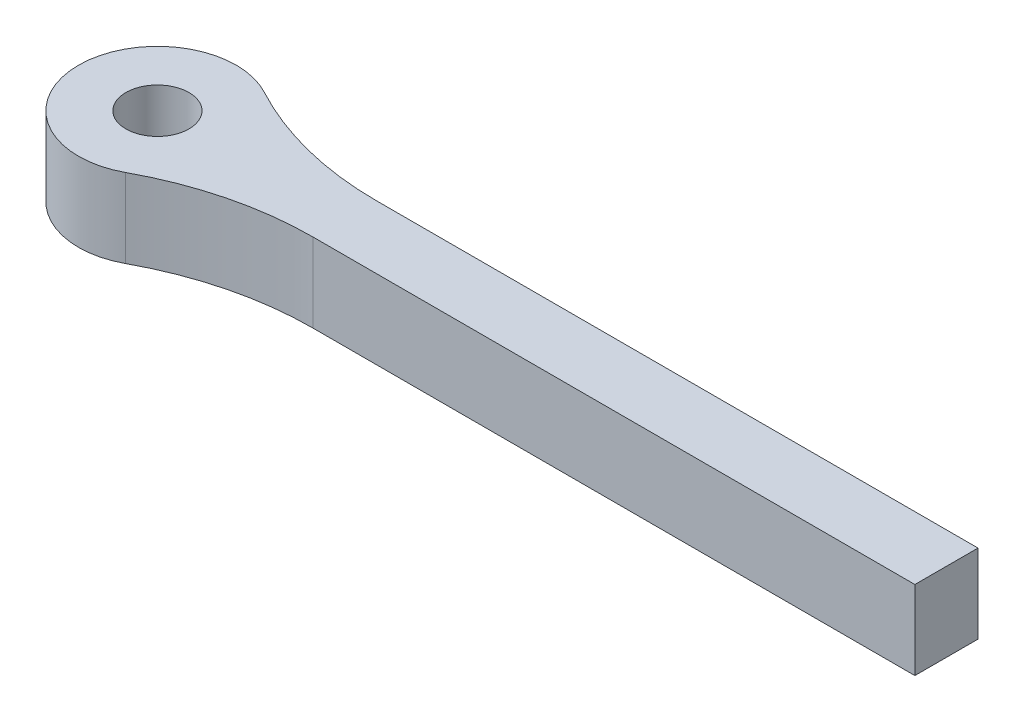
from build123d import *

# Parameters (mm, degrees)
BOSS_EXTRUDE1_DEPTH = 7.5
FILLET1_R           = 30
FILLET2_R           = 30


with BuildPart() as part:
    # Sketch1 → Boss-Extrude1 (new body)
    with BuildSketch(Plane(origin=(0, 0, 0), x_dir=(1, 0, 0), z_dir=(0, 1, 0))):
        with BuildLine():
            ThreePointArc((-58.191489362, -2.446808511), (-61.191489362, 0.553191489), (-58.191489362, 3.553191489))
            Line((-58.191489362, 3.553191489), (-51.317625819, 3.553191489))
            ThreePointArc((-51.317625819, 3.553191489), (-65.691489362, 0.553191489), (-51.317625819, -2.446808511))
            Line((-51.317625819, -2.446808511), (-58.191489362, -2.446808511))
        make_face()
        with BuildLine():
            Line((-51.317625819, 3.553191489), (-58.191489362, 3.553191489))
            ThreePointArc((-58.191489362, 3.553191489), (-56.070169018, 2.674511833), (-55.191489362, 0.553191489))
            ThreePointArc((-55.191489362, 0.553191489), (-56.070169018, -1.568128854), (-58.191489362, -2.446808511))
            Line((-58.191489362, -2.446808511), (-51.317625819, -2.446808511))
            ThreePointArc((-51.317625819, -2.446808511), (-50.849692015, -0.979130838), (-50.691489362, 0.553191489))
            ThreePointArc((-50.691489362, 0.553191489), (-50.849692015, 2.085513817), (-51.317625819, 3.553191489))
        make_face()
        with BuildLine():
            Line((16.808510638, 3.553191489), (-51.317625819, 3.553191489))
            ThreePointArc((-51.317625819, 3.553191489), (-50.849692015, 2.085513817), (-50.691489362, 0.553191489))
            ThreePointArc((-50.691489362, 0.553191489), (-50.849692015, -0.979130838), (-51.317625819, -2.446808511))
            Line((-51.317625819, -2.446808511), (16.808510638, -2.446808511))
            Line((16.808510638, -2.446808511), (16.808510638, 3.553191489))
        make_face()
    extrude(amount=BOSS_EXTRUDE1_DEPTH)

    # Fillet1
    fillet1_edges = [part.edges().sort_by_distance(p)[0] for p in [
        (-51.317625819, 3.75, 2.446808511),
    ]]
    fillet(fillet1_edges, radius=FILLET1_R)

    # Fillet2
    fillet2_edges = [part.edges().sort_by_distance(p)[0] for p in [
        (-51.317625819, 3.75, -3.553191489),
    ]]
    fillet(fillet2_edges, radius=FILLET2_R)


solid = part.part
